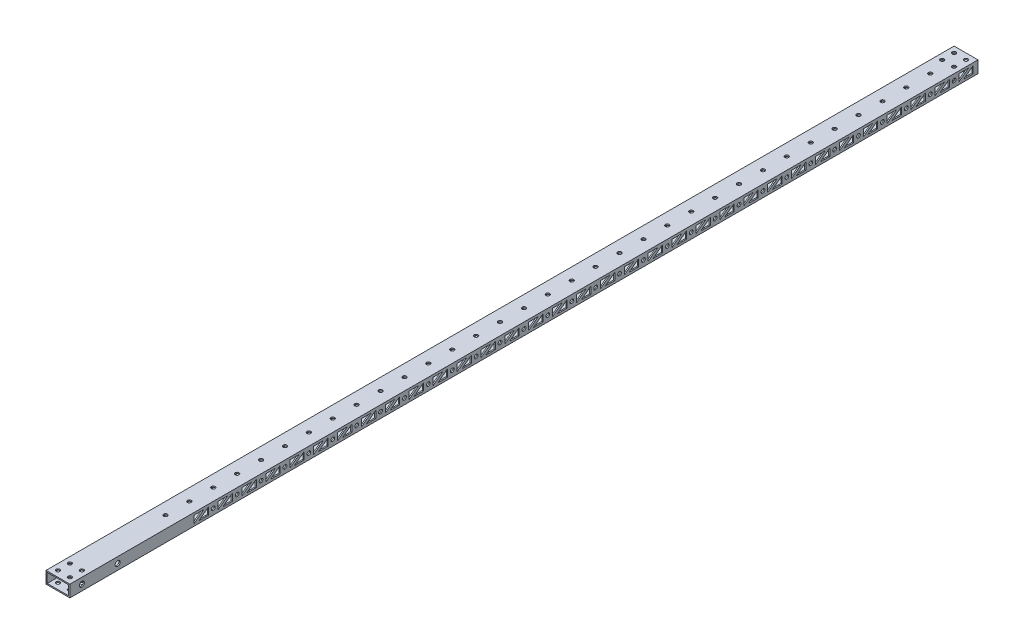
from build123d import *

# Parameters (mm, degrees)
SKETCH_1_W          = 20
SKETCH_1_H          = 10
SKETCH_1_W_2        = 18
SKETCH_1_H_2        = 8
EXTRUDE_1_DEPTH     = 760
SKETCH_2_R          = 1.575
CUT_EXTRUDE_1_DEPTH = 761.328876211
SKETCH_4_R          = 1.575
SKETCH_4_R_2        = 2.1
CUT_EXTRUDE_2_DEPTH = 761.328876211


with BuildPart() as part:
    # 草图1 → 拉伸-薄壁1 (new body)
    with BuildSketch(Plane.XY):
        with Locations((10, -5)):
            Rectangle(SKETCH_1_W, SKETCH_1_H)
        with Locations((10, -5)):
            Rectangle(SKETCH_1_W_2, SKETCH_1_H_2, mode=Mode.SUBTRACT)
    extrude(amount=EXTRUDE_1_DEPTH)

    # 草图2 → 切除-拉伸1 (cut, through all)
    with BuildSketch(Plane.XZ.offset(10)):
        with Locations(Location((5, 5, 0), (0, 0, 270))):
            Circle(SKETCH_2_R)
        with Locations(Location((15, 5, 0), (0, 0, 270))):
            Circle(SKETCH_2_R)
        with Locations(Location((15, 15, 0), (0, 0, 270))):
            Circle(SKETCH_2_R)
        with Locations(Location((5, 15, 0), (0, 0, 270))):
            Circle(SKETCH_2_R)
        with Locations(Location((10, 30, 0), (0, 0, 270))):
            Circle(SKETCH_2_R)
        with Locations(Location((10, 50, 0), (0, 0, 270))):
            Circle(SKETCH_2_R)
        with Locations(Location((10, 70, 0), (0, 0, 270))):
            Circle(SKETCH_2_R)
        with Locations(Location((10, 90, 0), (0, 0, 270))):
            Circle(SKETCH_2_R)
        with Locations(Location((10, 110, 0), (0, 0, 270))):
            Circle(SKETCH_2_R)
        with Locations(Location((10, 130, 0), (0, 0, 270))):
            Circle(SKETCH_2_R)
        with Locations(Location((10, 150, 0), (0, 0, 270))):
            Circle(SKETCH_2_R)
        with Locations(Location((10, 170, 0), (0, 0, 270))):
            Circle(SKETCH_2_R)
        with Locations(Location((10, 190, 0), (0, 0, 270))):
            Circle(SKETCH_2_R)
        with Locations(Location((10, 210, 0), (0, 0, 270))):
            Circle(SKETCH_2_R)
        with Locations(Location((10, 230, 0), (0, 0, 270))):
            Circle(SKETCH_2_R)
        with Locations(Location((10, 250, 0), (0, 0, 270))):
            Circle(SKETCH_2_R)
        with Locations(Location((10, 270, 0), (0, 0, 270))):
            Circle(SKETCH_2_R)
        with Locations(Location((10, 290, 0), (0, 0, 270))):
            Circle(SKETCH_2_R)
        with Locations(Location((10, 310, 0), (0, 0, 270))):
            Circle(SKETCH_2_R)
        with Locations(Location((10, 330, 0), (0, 0, 270))):
            Circle(SKETCH_2_R)
        with Locations(Location((10, 350, 0), (0, 0, 270))):
            Circle(SKETCH_2_R)
        with Locations(Location((10, 370, 0), (0, 0, 270))):
            Circle(SKETCH_2_R)
        with Locations(Location((10, 390, 0), (0, 0, 270))):
            Circle(SKETCH_2_R)
        with Locations(Location((10, 410, 0), (0, 0, 270))):
            Circle(SKETCH_2_R)
        with Locations(Location((10, 430, 0), (0, 0, 270))):
            Circle(SKETCH_2_R)
        with Locations(Location((10, 450, 0), (0, 0, 270))):
            Circle(SKETCH_2_R)
        with Locations(Location((10, 470, 0), (0, 0, 270))):
            Circle(SKETCH_2_R)
        with Locations(Location((10, 490, 0), (0, 0, 270))):
            Circle(SKETCH_2_R)
        with Locations(Location((10, 510, 0), (0, 0, 270))):
            Circle(SKETCH_2_R)
        with Locations(Location((10, 530, 0), (0, 0, 270))):
            Circle(SKETCH_2_R)
        with Locations(Location((10, 550, 0), (0, 0, 270))):
            Circle(SKETCH_2_R)
        with Locations(Location((10, 570, 0), (0, 0, 270))):
            Circle(SKETCH_2_R)
        with Locations(Location((10, 590, 0), (0, 0, 270))):
            Circle(SKETCH_2_R)
        with Locations(Location((10, 610, 0), (0, 0, 270))):
            Circle(SKETCH_2_R)
        with Locations(Location((5, 745, 0), (0, 0, 270))):
            Circle(SKETCH_2_R)
        with Locations(Location((15, 745, 0), (0, 0, 270))):
            Circle(SKETCH_2_R)
        with Locations(Location((15, 755, 0), (0, 0, 270))):
            Circle(SKETCH_2_R)
        with Locations(Location((5, 755, 0), (0, 0, 270))):
            Circle(SKETCH_2_R)
        with Locations(Location((10, 630, 0), (0, 0, 270))):
            Circle(SKETCH_2_R)
        with Locations(Location((10, 650, 0), (0, 0, 270))):
            Circle(SKETCH_2_R)
        with Locations(Location((10, 670, 0), (0, 0, 270))):
            Circle(SKETCH_2_R)
    extrude(amount=-CUT_EXTRUDE_1_DEPTH, mode=Mode.SUBTRACT)

    # 草图4 → 切除-拉伸2 (cut, through all)
    with BuildSketch(Plane(origin=(20, 0, 0), x_dir=(0, 0, -1), z_dir=(1, 0, 0))):
        with Locations(Location((-20, -5, 0), (0, 0, 90))):
            Circle(SKETCH_4_R)
        with Locations(Location((-40, -5, 0), (0, 0, 90))):
            Circle(SKETCH_4_R)
        with Locations(Location((-60, -5, 0), (0, 0, 90))):
            Circle(SKETCH_4_R)
        with Locations(Location((-80, -5, 0), (0, 0, 90))):
            Circle(SKETCH_4_R)
        with Locations(Location((-100, -5, 0), (0, 0, 90))):
            Circle(SKETCH_4_R)
        with Locations(Location((-120, -5, 0), (0, 0, 90))):
            Circle(SKETCH_4_R)
        with Locations(Location((-140, -5, 0), (0, 0, 90))):
            Circle(SKETCH_4_R)
        with Locations(Location((-160, -5, 0), (0, 0, 90))):
            Circle(SKETCH_4_R)
        with Locations(Location((-180, -5, 0), (0, 0, 90))):
            Circle(SKETCH_4_R)
        with Locations(Location((-200, -5, 0), (0, 0, 90))):
            Circle(SKETCH_4_R)
        with Locations(Location((-220, -5, 0), (0, 0, 90))):
            Circle(SKETCH_4_R)
        with Locations(Location((-240, -5, 0), (0, 0, 90))):
            Circle(SKETCH_4_R)
        with Locations(Location((-260, -5, 0), (0, 0, 90))):
            Circle(SKETCH_4_R)
        with Locations(Location((-280, -5, 0), (0, 0, 90))):
            Circle(SKETCH_4_R)
        with Locations(Location((-300, -5, 0), (0, 0, 90))):
            Circle(SKETCH_4_R)
        with Locations(Location((-320, -5, 0), (0, 0, 90))):
            Circle(SKETCH_4_R)
        with Locations(Location((-340, -5, 0), (0, 0, 90))):
            Circle(SKETCH_4_R)
        with Locations(Location((-360, -5, 0), (0, 0, 90))):
            Circle(SKETCH_4_R)
        with Locations(Location((-380, -5, 0), (0, 0, 90))):
            Circle(SKETCH_4_R)
        with Locations(Location((-400, -5, 0), (0, 0, 90))):
            Circle(SKETCH_4_R)
        with Locations(Location((-420, -5, 0), (0, 0, 90))):
            Circle(SKETCH_4_R)
        with Locations(Location((-440, -5, 0), (0, 0, 90))):
            Circle(SKETCH_4_R)
        with Locations(Location((-460, -5, 0), (0, 0, 90))):
            Circle(SKETCH_4_R)
        with Locations(Location((-480, -5, 0), (0, 0, 90))):
            Circle(SKETCH_4_R)
        with Locations(Location((-500, -5, 0), (0, 0, 90))):
            Circle(SKETCH_4_R)
        with Locations(Location((-520, -5, 0), (0, 0, 90))):
            Circle(SKETCH_4_R)
        with Locations(Location((-540, -5, 0), (0, 0, 90))):
            Circle(SKETCH_4_R)
        with Locations(Location((-560, -5, 0), (0, 0, 90))):
            Circle(SKETCH_4_R)
        with Locations(Location((-580, -5, 0), (0, 0, 90))):
            Circle(SKETCH_4_R)
        with Locations(Location((-600, -5, 0), (0, 0, 90))):
            Circle(SKETCH_4_R)
        with Locations(Location((-620, -5, 0), (0, 0, 90))):
            Circle(SKETCH_4_R)
        with Locations(Location((-640, -5, 0), (0, 0, 90))):
            Circle(SKETCH_4_R)
        with Locations(Location((-750, -5, 0), (0, 0, 90))):
            Circle(SKETCH_4_R_2)
        with Locations(Location((-720, -5, 0), (0, 0, 90))):
            Circle(SKETCH_4_R_2)
        Polygon((-4, -2), (-4, -8), (-12, -8), align=None)
        Polygon((-8, -2), (-16, -8), (-16, -2), align=None)
        Polygon((-24, -2), (-24, -8), (-32, -8), align=None)
        Polygon((-36, -2), (-28, -2), (-36, -8), align=None)
        Polygon((-44, -2), (-44, -8), (-52, -8), align=None)
        Polygon((-56, -2), (-48, -2), (-56, -8), align=None)
        Polygon((-64, -2), (-64, -8), (-72, -8), align=None)
        Polygon((-76, -2), (-68, -2), (-76, -8), align=None)
        Polygon((-84, -2), (-84, -8), (-92, -8), align=None)
        Polygon((-96, -2), (-88, -2), (-96, -8), align=None)
        Polygon((-104, -2), (-104, -8), (-112, -8), align=None)
        Polygon((-116, -2), (-108, -2), (-116, -8), align=None)
        Polygon((-124, -2), (-124, -8), (-132, -8), align=None)
        Polygon((-136, -2), (-128, -2), (-136, -8), align=None)
        Polygon((-144, -2), (-144, -8), (-152, -8), align=None)
        Polygon((-156, -2), (-148, -2), (-156, -8), align=None)
        Polygon((-164, -2), (-164, -8), (-172, -8), align=None)
        Polygon((-176, -2), (-168, -2), (-176, -8), align=None)
        Polygon((-184, -2), (-184, -8), (-192, -8), align=None)
        Polygon((-196, -2), (-188, -2), (-196, -8), align=None)
        Polygon((-204, -2), (-204, -8), (-212, -8), align=None)
        Polygon((-216, -2), (-208, -2), (-216, -8), align=None)
        Polygon((-224, -2), (-224, -8), (-232, -8), align=None)
        Polygon((-236, -2), (-228, -2), (-236, -8), align=None)
        Polygon((-244, -2), (-244, -8), (-252, -8), align=None)
        Polygon((-256, -2), (-248, -2), (-256, -8), align=None)
        Polygon((-264, -2), (-264, -8), (-272, -8), align=None)
        Polygon((-276, -2), (-268, -2), (-276, -8), align=None)
        Polygon((-284, -2), (-284, -8), (-292, -8), align=None)
        Polygon((-296, -2), (-288, -2), (-296, -8), align=None)
        Polygon((-304, -2), (-304, -8), (-312, -8), align=None)
        Polygon((-316, -2), (-308, -2), (-316, -8), align=None)
        Polygon((-324, -2), (-324, -8), (-332, -8), align=None)
        Polygon((-336, -2), (-328, -2), (-336, -8), align=None)
        Polygon((-344, -2), (-344, -8), (-352, -8), align=None)
        Polygon((-356, -2), (-348, -2), (-356, -8), align=None)
        Polygon((-364, -2), (-364, -8), (-372, -8), align=None)
        Polygon((-376, -2), (-368, -2), (-376, -8), align=None)
        Polygon((-384, -2), (-384, -8), (-392, -8), align=None)
        Polygon((-396, -2), (-388, -2), (-396, -8), align=None)
        Polygon((-404, -2), (-404, -8), (-412, -8), align=None)
        Polygon((-416, -2), (-408, -2), (-416, -8), align=None)
        Polygon((-424, -2), (-424, -8), (-432, -8), align=None)
        Polygon((-436, -2), (-428, -2), (-436, -8), align=None)
        Polygon((-444, -2), (-444, -8), (-452, -8), align=None)
        Polygon((-456, -2), (-448, -2), (-456, -8), align=None)
        Polygon((-464, -2), (-464, -8), (-472, -8), align=None)
        Polygon((-476, -2), (-468, -2), (-476, -8), align=None)
        Polygon((-484, -2), (-484, -8), (-492, -8), align=None)
        Polygon((-496, -2), (-488, -2), (-496, -8), align=None)
        Polygon((-504, -2), (-504, -8), (-512, -8), align=None)
        Polygon((-516, -2), (-508, -2), (-516, -8), align=None)
        Polygon((-524, -2), (-524, -8), (-532, -8), align=None)
        Polygon((-536, -2), (-528, -2), (-536, -8), align=None)
        Polygon((-544, -2), (-544, -8), (-552, -8), align=None)
        Polygon((-556, -2), (-548, -2), (-556, -8), align=None)
        Polygon((-564, -2), (-564, -8), (-572, -8), align=None)
        Polygon((-576, -2), (-568, -2), (-576, -8), align=None)
        Polygon((-584, -2), (-584, -8), (-592, -8), align=None)
        Polygon((-596, -2), (-588, -2), (-596, -8), align=None)
        Polygon((-604, -2), (-604, -8), (-612, -8), align=None)
        Polygon((-616, -2), (-608, -2), (-616, -8), align=None)
        Polygon((-624, -2), (-624, -8), (-632, -8), align=None)
        Polygon((-636, -2), (-628, -2), (-636, -8), align=None)
        Polygon((-644, -2), (-644, -8), (-652, -8), align=None)
        Polygon((-656, -2), (-648, -2), (-656, -8), align=None)
    extrude(amount=-CUT_EXTRUDE_2_DEPTH, mode=Mode.SUBTRACT)


solid = part.part
